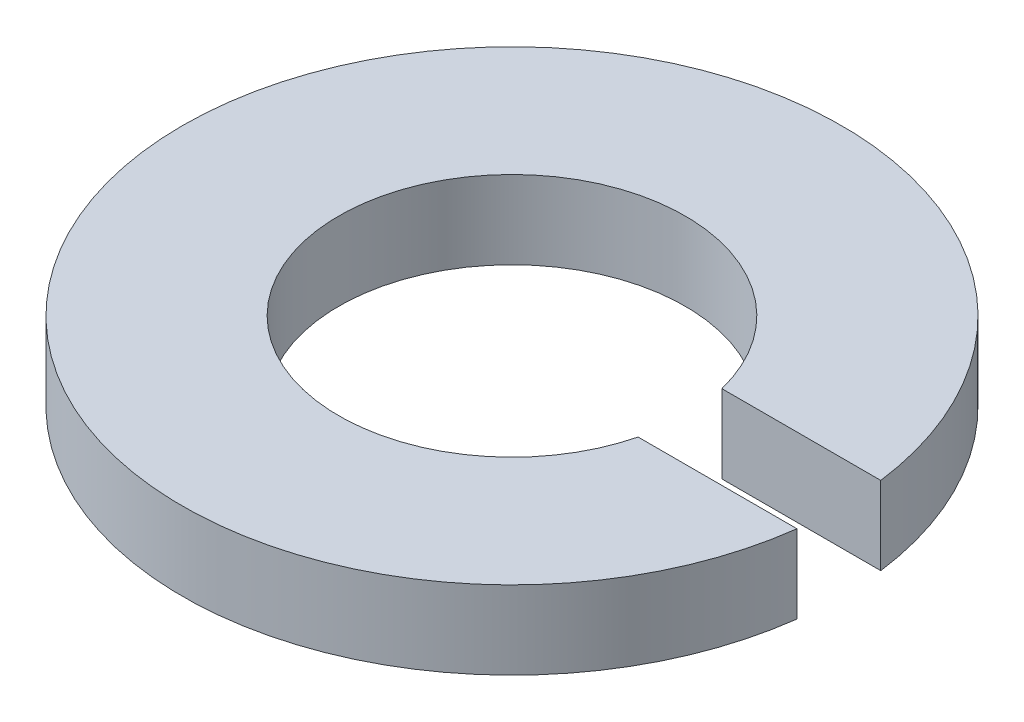
from build123d import *

# Parameters (mm, degrees)
EXTRUDE_1_DEPTH = 0.7


with BuildPart() as part:
    # ｽｹｯﾁ1 → ﾎﾞｽ - 押し出し1 (new body)
    with BuildSketch(Plane(origin=(0, 0, 0), x_dir=(1, 0, 0), z_dir=(0, 1, 0))):
        with BuildLine():
            ThreePointArc((1.503953124, -0.375), (-1.55, 0), (1.503953124, 0.375))
            Line((1.503953124, 0.375), (2.926068181, 0.375))
            ThreePointArc((2.926068181, 0.375), (-2.95, 0), (2.926068181, -0.375))
            Line((2.926068181, -0.375), (1.503953124, -0.375))
        make_face()
    extrude(amount=EXTRUDE_1_DEPTH)


solid = part.part
